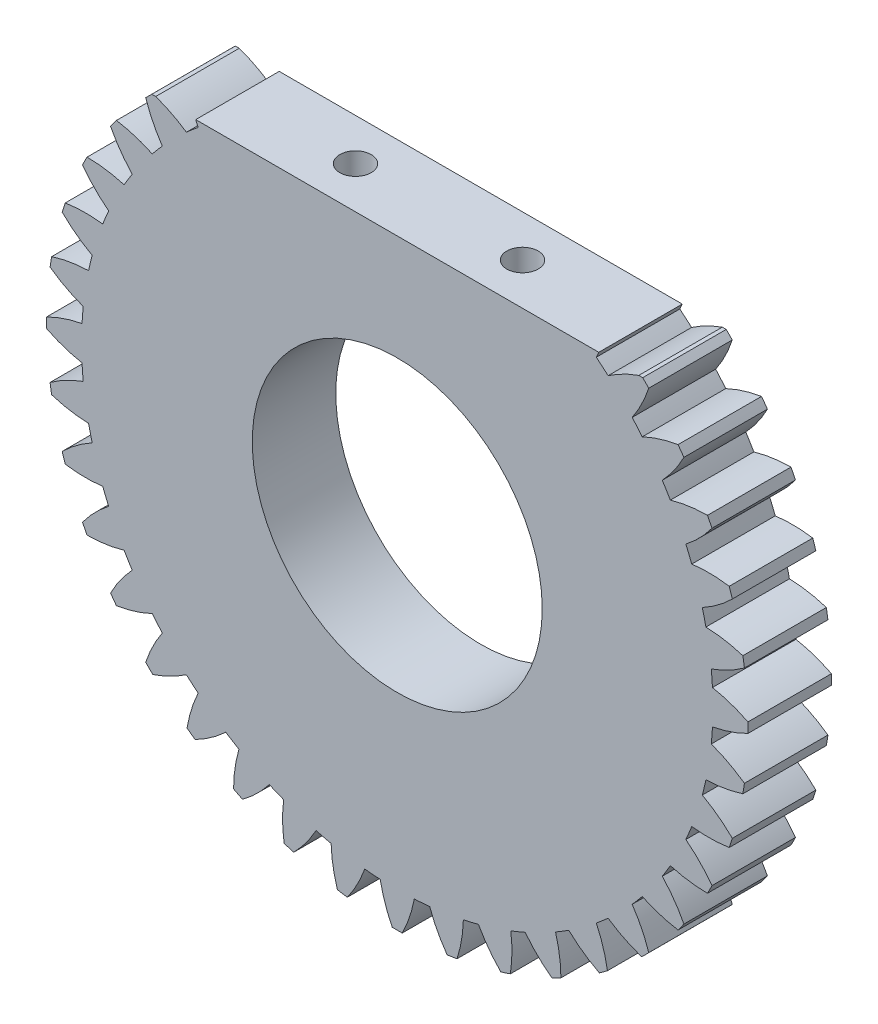
from build123d import *

# Parameters (mm, degrees)
SKETCH1_R               = 24.003
BOSS_EXTRUDE1_DEPTH     = 3.175
BOSS_EXTRUDE2_DEPTH     = 6.35
CIRPATTERN2_COUNT       = 40
SKETCH3_W               = 50.8
SKETCH3_H               = 12.7
CUT_EXTRUDE1_DEPTH      = 39.24787968
SKETCH6_R               = 11.025
CUT_EXTRUDE4_DEPTH      = 39.24787968
CUT_EXTRUDE5_DEPTH      = 54.02535172
CUT_EXTRUDE5_DEPTH_BACK = 7.8232
SKETCH7_R               = 1.1938


with BuildPart() as part:
    # Sketch1 → Boss-Extrude1 (new, symmetric)
    with BuildSketch(Plane.XY):
        Circle(SKETCH1_R)
    extrude(amount=BOSS_EXTRUDE1_DEPTH, both=True)

    # Sketch2 → Boss-Extrude2 (add)
    with BuildSketch(Plane.XY.offset(3.175)):
        with BuildLine():
            ThreePointArc((-1.2954, 23.968019272), (-0.933314657, 25.349869857), (-0.381, 26.667278433))
            ThreePointArc((-0.381, 26.667278433), (0, 26.67), (0.381, 26.667278433))
            ThreePointArc((0.381, 26.667278433), (0.933314657, 25.349869857), (1.2954, 23.968019272))
            ThreePointArc((1.2954, 23.968019272), (0, 24.003), (-1.2954, 23.968019272))
        make_face()
    boss_extrude2 = extrude(amount=-BOSS_EXTRUDE2_DEPTH)

    # CirPattern2: Boss-Extrude2 ×40 about axis
    cirpattern2_axis = Axis((0, 0, 0), (0, 0, 1))
    for i in range(1, CIRPATTERN2_COUNT):
        add(boss_extrude2.rotate(cirpattern2_axis, i * 360 / CIRPATTERN2_COUNT))

    # Sketch3 → Cut-Extrude1 (cut, through all)
    with BuildSketch(Plane.XY.offset(3.175)):
        with Locations((0, 25.4)):
            Rectangle(SKETCH3_W, SKETCH3_H)
    extrude(amount=-CUT_EXTRUDE1_DEPTH, mode=Mode.SUBTRACT)

    # Sketch6 → Cut-Extrude4 (cut, through all)
    with BuildSketch(Plane.XY.offset(3.175)):
        Circle(SKETCH6_R)
    extrude(amount=-CUT_EXTRUDE4_DEPTH, mode=Mode.SUBTRACT)

    # Sketch7 → Cut-Extrude5 (cut, two sides: drawn at the far end of the back side and taken through both)
    with BuildSketch(Plane(origin=(0, 19.05, 0), x_dir=(1, 0, 0), z_dir=(0, 1, 0)).offset(-CUT_EXTRUDE5_DEPTH_BACK)):
        with Locations((-6.35, 0)):
            Circle(SKETCH7_R)
        with Locations((6.35, 0)):
            Circle(SKETCH7_R)
    extrude(amount=CUT_EXTRUDE5_DEPTH + CUT_EXTRUDE5_DEPTH_BACK, mode=Mode.SUBTRACT)


solid = part.part
